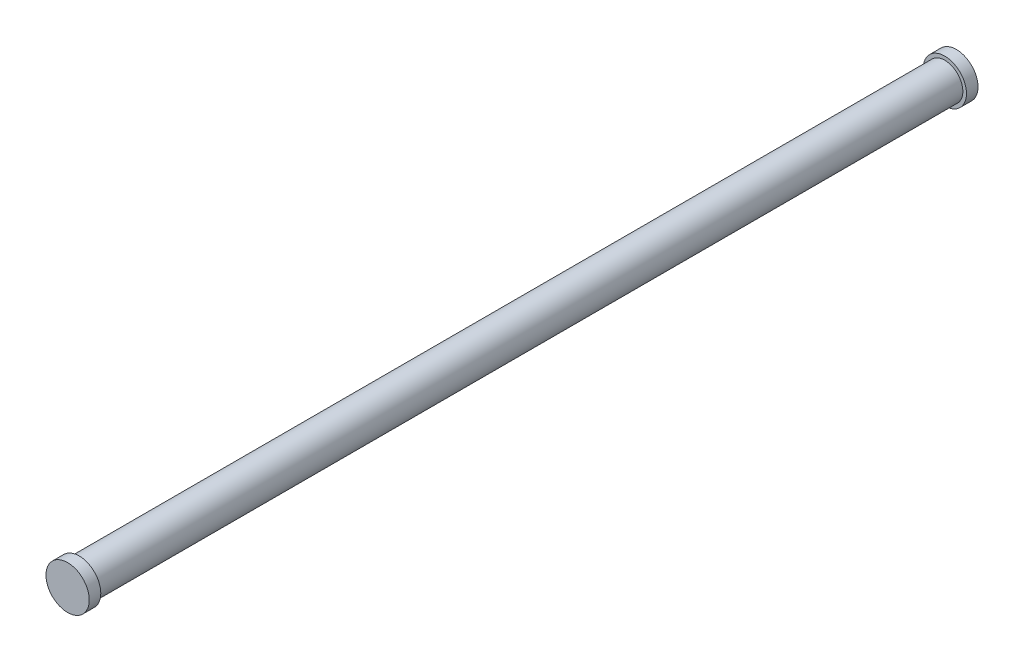
from build123d import *

# Parameters (mm, degrees)
CROQUIS1_R              = 12.5
SALIENTE_EXTRUIR1_DEPTH = 600
CROQUIS2_R              = 15
SALIENTE_EXTRUIR2_DEPTH = 8


with BuildPart() as part:
    # Croquis1 → Saliente-Extruir1 (new body)
    with BuildSketch(Plane.XY):
        Circle(CROQUIS1_R)
    extrude(amount=-SALIENTE_EXTRUIR1_DEPTH)

    # Croquis2 → Saliente-Extruir2 (add)
    with BuildSketch(Plane.XY):
        Circle(CROQUIS2_R)
    saliente_extruir2 = extrude(amount=SALIENTE_EXTRUIR2_DEPTH)

    # Simetría1: Saliente-Extruir2 across plane
    add(saliente_extruir2.mirror(Plane.XY.offset(-300)))


solid = part.part
